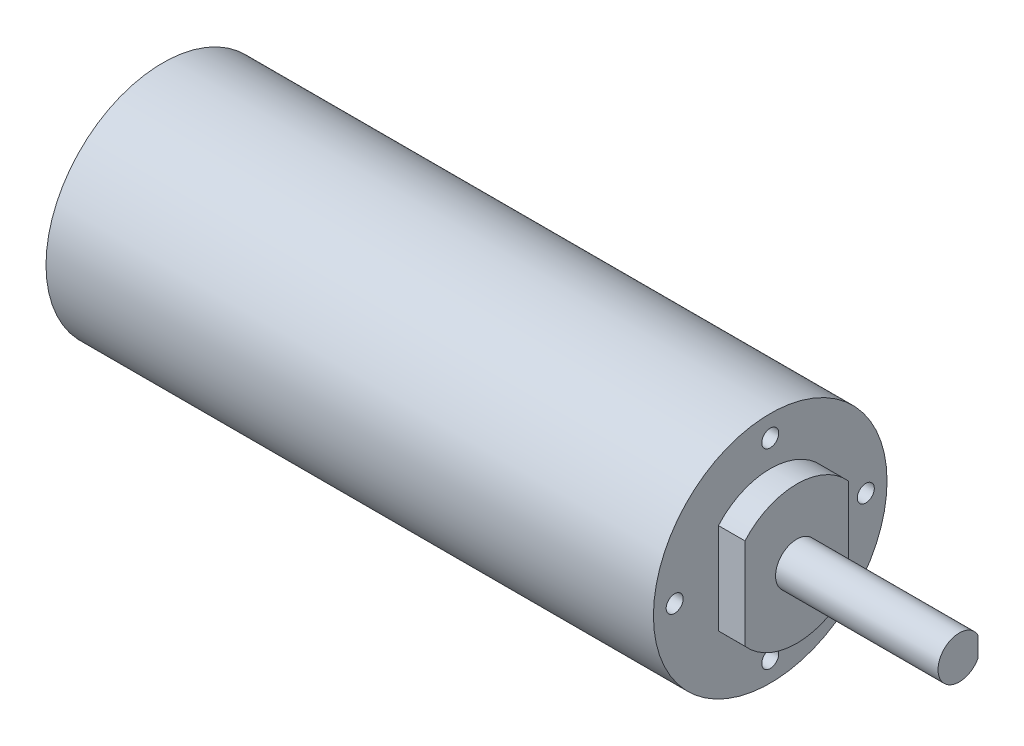
from build123d import *

# Parameters (mm, degrees)
SKETCH1_R                       = 11
BOSS_EXTRUDE1_DEPTH             = 57.2
TAP_DRILL_FOR_M2X0_4_TAP1_D     = 1.6
TAP_DRILL_FOR_M2X0_4_TAP1_DEPTH = 4
TAP_DRILL_FOR_M2X0_4_TAP1_TIP   = 0.480688495
BOSS_EXTRUDE2_DEPTH             = 2.5
BOSS_EXTRUDE3_DEPTH             = 15.3


with BuildPart() as part:
    # Sketch1 → Boss-Extrude1 (new body)
    with BuildSketch(Plane(origin=(0, 0, 0), x_dir=(0, 0, -1), z_dir=(1, 0, 0))):
        Circle(SKETCH1_R)
    extrude(amount=BOSS_EXTRUDE1_DEPTH)

    # Tap Drill for M2x0.4 Tap1
    with Locations(Plane(origin=(57.2, 0, 0), x_dir=(0, 0, -1), z_dir=(1, 0, 0))):
        with Locations((9, 0), (0, 9), (-9, 0), (0, -9)):
            Hole(TAP_DRILL_FOR_M2X0_4_TAP1_D / 2, depth=TAP_DRILL_FOR_M2X0_4_TAP1_DEPTH)
            with Locations((0, 0, -(TAP_DRILL_FOR_M2X0_4_TAP1_DEPTH + TAP_DRILL_FOR_M2X0_4_TAP1_TIP / 2))):  # 118° drill point
                Cone(0, TAP_DRILL_FOR_M2X0_4_TAP1_D / 2, TAP_DRILL_FOR_M2X0_4_TAP1_TIP, mode=Mode.SUBTRACT)

    # Sketch4 → Boss-Extrude2 (add)
    with BuildSketch(Plane(origin=(57.2, 0, 0), x_dir=(0, 0, -1), z_dir=(1, 0, 0))):
        with BuildLine():
            Line((4.877567481, -4.296432877), (4.877567481, 4.296432877))
            ThreePointArc((4.877567481, 4.296432877), (0, 6.5), (-4.877567481, 4.296432877))
            Line((-4.877567481, 4.296432877), (-4.877567481, -4.296432877))
            ThreePointArc((-4.877567481, -4.296432877), (0, -6.5), (4.877567481, -4.296432877))
        make_face()
    extrude(amount=BOSS_EXTRUDE2_DEPTH)

    # Sketch5 → Boss-Extrude3 (add)
    with BuildSketch(Plane(origin=(59.7, 0, 0), x_dir=(0, 0, -1), z_dir=(1, 0, 0))):
        with BuildLine():
            Line((1.765106223, -0.940425447), (1.765106223, 0.940425447))
            ThreePointArc((1.765106223, 0.940425447), (-2, 0), (1.765106223, -0.940425447))
        make_face()
    extrude(amount=BOSS_EXTRUDE3_DEPTH)


solid = part.part
